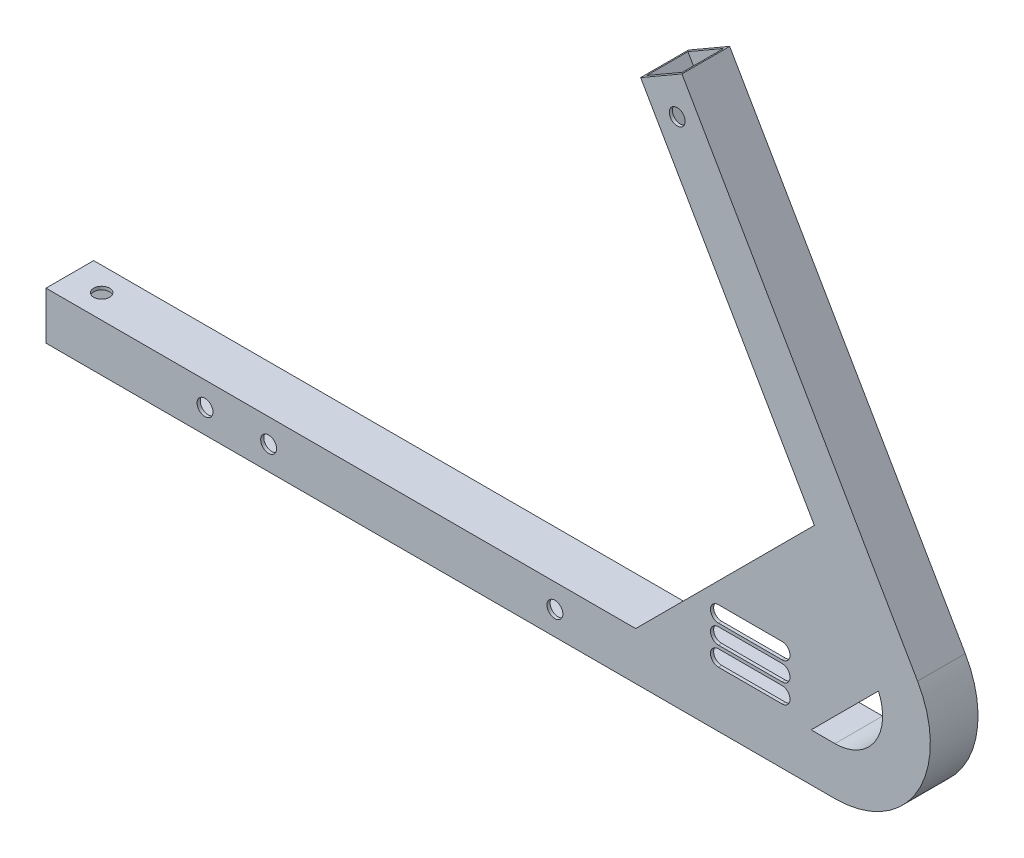
from build123d import *

# Parameters (mm, degrees)
BOSS_EXTRUDE1_DEPTH     = 38.1
SHELL1_T                = -2.54
CUT_EXTRUDE1_REACH      = 782.53
SKETCH3_W               = 33.02
SKETCH3_H               = 33.02
BOSS_EXTRUDE2_DEPTH     = 2.54
SKETCH5_R               = 6.35
CUT_EXTRUDE2_DEPTH      = 575.603362093
SKETCH7_W               = 38.1
SKETCH7_H               = 38.1
SKETCH7_W_2             = 33.02
SKETCH7_H_2             = 33.02
BOSS_EXTRUDE3_DEPTH     = 127
CUT_EXTRUDE4_REACH      = 620.716
SKETCH8_R               = 6.35
CUT_EXTRUDE6_DEPTH      = 644.98208109
CUT_EXTRUDE6_DEPTH_BACK = 644.98208109
CUT_EXTRUDE7_REACH      = 646.127
SKETCH11_R              = 6.35


with BuildPart() as part:
    # Sketch1 → Boss-Extrude1 (new body)
    with BuildSketch(Plane.XY):
        with BuildLine():
            Line((102.652877862, 330.2), (227.30280098, 114.3))
            ThreePointArc((227.30280098, 114.3), (227.30280098, 38.1), (161.311665212, 0))
            Line((161.311665212, 0), (-468.706063252, 0))
            Line((-468.706063252, 0), (-468.706063252, 38.1))
            Line((-468.706063252, 38.1), (161.311665212, 38.1))
            ThreePointArc((161.311665212, 38.1), (194.307233096, 57.15), (194.307233096, 95.25))
            Line((194.307233096, 95.25), (69.657309978, 311.15))
            Line((69.657309978, 311.15), (102.652877862, 330.2))
        make_face()
    extrude(amount=-BOSS_EXTRUDE1_DEPTH)

    # Shell1
    shell1_openings = [part.faces().sort_by_distance(p)[0] for p in [
        (86.15509392, 320.675, -19.05),
    ]]
    offset(amount=SHELL1_T, openings=shell1_openings, kind=Kind.INTERSECTION)

    # Sketch3 → Cut-Extrude1 (cut, up to next)
    with BuildSketch(Plane.ZY.offset(468.706063252), mode=Mode.PRIVATE) as cut_extrude1_sk1:
        with Locations((-19.05, 19.05)):
            Rectangle(SKETCH3_W, SKETCH3_H)
    cut_extrude1_tool1 = extrude(cut_extrude1_sk1.sketch, amount=-CUT_EXTRUDE1_REACH, mode=Mode.PRIVATE) & part.part
    add(cut_extrude1_tool1.solids().sort_by_distance((-468.706063, 19.05, -19.05))[0], mode=Mode.SUBTRACT)

    # Sketch4 → Boss-Extrude2 (add)
    with BuildSketch(Plane.XY):
        Polygon((2.178975516, 38.1), (144.901761863, 180.822786347), (196.194281247, 91.981536726), (142.31274452, 38.1), align=None)
    extrude(amount=-BOSS_EXTRUDE2_DEPTH)

    # Sketch5 → Cut-Extrude2 (cut, through all)
    with BuildSketch(Plane.XY):
        with Locations((-62.306063252, 19.05)):
            Circle(SKETCH5_R)
        with Locations((-290.906063252, 19.05)):
            Circle(SKETCH5_R)
        with Locations((-341.706063252, 19.05)):
            Circle(SKETCH5_R)
    extrude(amount=-CUT_EXTRUDE2_DEPTH, mode=Mode.SUBTRACT)

    # Sketch7 → Boss-Extrude3 (add)
    with BuildSketch(Plane(origin=(-117.317574699, 203.2, 0), x_dir=(0.8660254037844362, 0.5000000000000044, 0), z_dir=(-0.5000000000000044, 0.8660254037844362, 0))):
        with Locations((234.95, 19.05)):
            Rectangle(SKETCH7_W, SKETCH7_H)
        with Locations((234.95, 19.05)):
            Rectangle(SKETCH7_W_2, SKETCH7_H_2, mode=Mode.SUBTRACT)
    extrude(amount=BOSS_EXTRUDE3_DEPTH)

    # Sketch8 → Cut-Extrude4 (cut, up to next)
    with BuildSketch(Plane(origin=(0, 38.1, 0), x_dir=(1, 0, 0), z_dir=(0, 1, 0)), mode=Mode.PRIVATE) as cut_extrude4_sk1:
        with Locations(Location((-443.306063252, 19.05, 0), (0, 0, 180))):
            Circle(SKETCH8_R)
    cut_extrude4_tool1 = extrude(cut_extrude4_sk1.sketch, amount=-CUT_EXTRUDE4_REACH, mode=Mode.PRIVATE) & part.part
    add(cut_extrude4_tool1.solids().sort_by_distance((-443.306063, 38.1, -19.05))[0], mode=Mode.SUBTRACT)

    # Sketch10 → Cut-Extrude6 (cut, two sides: drawn at the far end of the back side and taken through both)
    with BuildSketch(Plane(origin=(0, 0, -2.54), x_dir=(-1, 0, 0), z_dir=(0, 0, -1)).offset(-CUT_EXTRUDE6_DEPTH_BACK)):
        with BuildLine():
            Line((-68.291720036, 57.15), (-119.091720036, 57.15))
            ThreePointArc((-119.091720036, 57.15), (-125.441720036, 50.8), (-119.091720036, 44.45))
            Line((-119.091720036, 44.45), (-68.291720036, 44.45))
            ThreePointArc((-68.291720036, 44.45), (-61.941720036, 50.8), (-68.291720036, 57.15))
        make_face()
        with BuildLine():
            Line((-68.291720036, 72.39), (-119.091720036, 72.39))
            ThreePointArc((-119.091720036, 72.39), (-125.441720036, 66.04), (-119.091720036, 59.69))
            Line((-119.091720036, 59.69), (-68.291720036, 59.69))
            ThreePointArc((-68.291720036, 59.69), (-61.941720036, 66.04), (-68.291720036, 72.39))
        make_face()
        with BuildLine():
            Line((-68.291720036, 87.63), (-119.091720036, 87.63))
            ThreePointArc((-119.091720036, 87.63), (-125.441720036, 81.28), (-119.091720036, 74.93))
            Line((-119.091720036, 74.93), (-68.291720036, 74.93))
            ThreePointArc((-68.291720036, 74.93), (-61.941720036, 81.28), (-68.291720036, 87.63))
        make_face()
    extrude(amount=CUT_EXTRUDE6_DEPTH + CUT_EXTRUDE6_DEPTH_BACK, mode=Mode.SUBTRACT)

    # Sketch11 → Cut-Extrude7 (cut, up to next)
    with BuildSketch(Plane.XY, mode=Mode.PRIVATE) as cut_extrude7_sk1:
        with Locations((35.366501125, 408.643423165)):
            Circle(SKETCH11_R)
    cut_extrude7_tool1 = extrude(cut_extrude7_sk1.sketch, amount=-CUT_EXTRUDE7_REACH, mode=Mode.PRIVATE) & part.part
    add(cut_extrude7_tool1.solids().sort_by_distance((35.366501, 408.643423, 0))[0], mode=Mode.SUBTRACT)


solid = part.part
